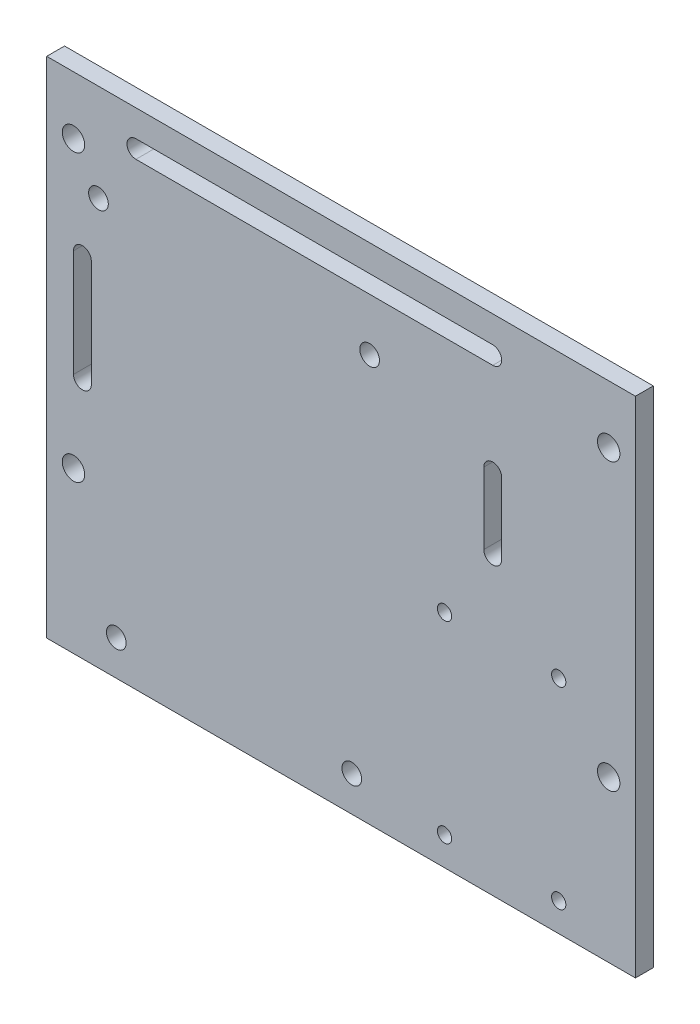
from build123d import *

# Parameters (mm, degrees)
SKETCH1_W           = 104.775
SKETCH1_H           = 114.3
BOSS_EXTRUDE1_DEPTH = 3.175
SKETCH2_R           = 1.7526
CUT_EXTRUDE1_DEPTH  = 78.592868753
SKETCH3_R           = 2
CUT_EXTRUDE2_DEPTH  = 78.592868753
SKETCH4_R           = 1.27
CUT_EXTRUDE3_DEPTH  = 78.592868753
SKETCH5_W           = 104.775
SKETCH5_H           = 49.262233524
CUT_EXTRUDE4_DEPTH  = 15
CUT_EXTRUDE5_DEPTH  = 78.592868753


with BuildPart() as part:
    # Sketch1 → Boss-Extrude1 (new body)
    with BuildSketch(Plane.XY):
        Rectangle(SKETCH1_W, SKETCH1_H)
    extrude(amount=BOSS_EXTRUDE1_DEPTH)

    # Sketch2 → Cut-Extrude1 (cut, through all)
    with BuildSketch(Plane.XY.offset(3.175)):
        with Locations((-43.18, 15.24)):
            Circle(SKETCH2_R)
        with Locations((5.08, 15.24)):
            Circle(SKETCH2_R)
        with Locations((-40.005, -50.8762)):
            Circle(SKETCH2_R)
        with Locations((1.905, -50.8762)):
            Circle(SKETCH2_R)
    extrude(amount=-CUT_EXTRUDE1_DEPTH, mode=Mode.SUBTRACT)

    # Sketch3 → Cut-Extrude2 (cut, through all)
    with BuildSketch(Plane.XY.offset(3.175)):
        with Locations((-47.625, 22.225)):
            Circle(SKETCH3_R)
        with Locations((47.625, 22.225)):
            Circle(SKETCH3_R)
        with Locations((47.625, -28.575)):
            Circle(SKETCH3_R)
        with Locations((-47.625, -28.575)):
            Circle(SKETCH3_R)
    extrude(amount=-CUT_EXTRUDE2_DEPTH, mode=Mode.SUBTRACT)

    # Sketch4 → Cut-Extrude3 (cut, through all)
    with BuildSketch(Plane.XY.offset(3.175)):
        with Locations((18.415, -17.78)):
            Circle(SKETCH4_R)
        with Locations((38.735, -17.78)):
            Circle(SKETCH4_R)
        with Locations((38.735, -52.07)):
            Circle(SKETCH4_R)
        with Locations((18.415, -52.07)):
            Circle(SKETCH4_R)
    extrude(amount=-CUT_EXTRUDE3_DEPTH, mode=Mode.SUBTRACT)

    # Sketch5 → Cut-Extrude4 (cut)
    with BuildSketch(Plane.XY.offset(3.175)):
        with Locations((0, 57.15)):
            Rectangle(SKETCH5_W, SKETCH5_H)
    extrude(amount=-CUT_EXTRUDE4_DEPTH, mode=Mode.SUBTRACT)

    # Sketch7 → Cut-Extrude5 (cut, through all)
    with BuildSketch(Plane.XY.offset(3.175)):
        with BuildLine():
            Line((-44.45, 4.92426118), (-44.45, -14.12573882))
            ThreePointArc((-44.45, -14.12573882), (-46.0375, -15.71323882), (-47.625, -14.12573882))
            Line((-47.625, -14.12573882), (-47.625, 4.92426118))
            ThreePointArc((-47.625, 4.92426118), (-46.0375, 6.51176118), (-44.45, 4.92426118))
        make_face()
        with BuildLine():
            Line((-36.5125, 27.756383238), (26.9875, 27.756383238))
            ThreePointArc((26.9875, 27.756383238), (28.575, 26.168883238), (26.9875, 24.581383238))
            Line((26.9875, 24.581383238), (-36.5125, 24.581383238))
            ThreePointArc((-36.5125, 24.581383238), (-38.1, 26.168883238), (-36.5125, 27.756383238))
        make_face()
        with BuildLine():
            Line((28.575, 8.09926118), (28.575, -4.60073882))
            ThreePointArc((28.575, -4.60073882), (26.9875, -6.18823882), (25.4, -4.60073882))
            Line((25.4, -4.60073882), (25.4, 8.09926118))
            ThreePointArc((25.4, 8.09926118), (26.9875, 9.68676118), (28.575, 8.09926118))
        make_face()
    extrude(amount=-CUT_EXTRUDE5_DEPTH, mode=Mode.SUBTRACT)


solid = part.part
